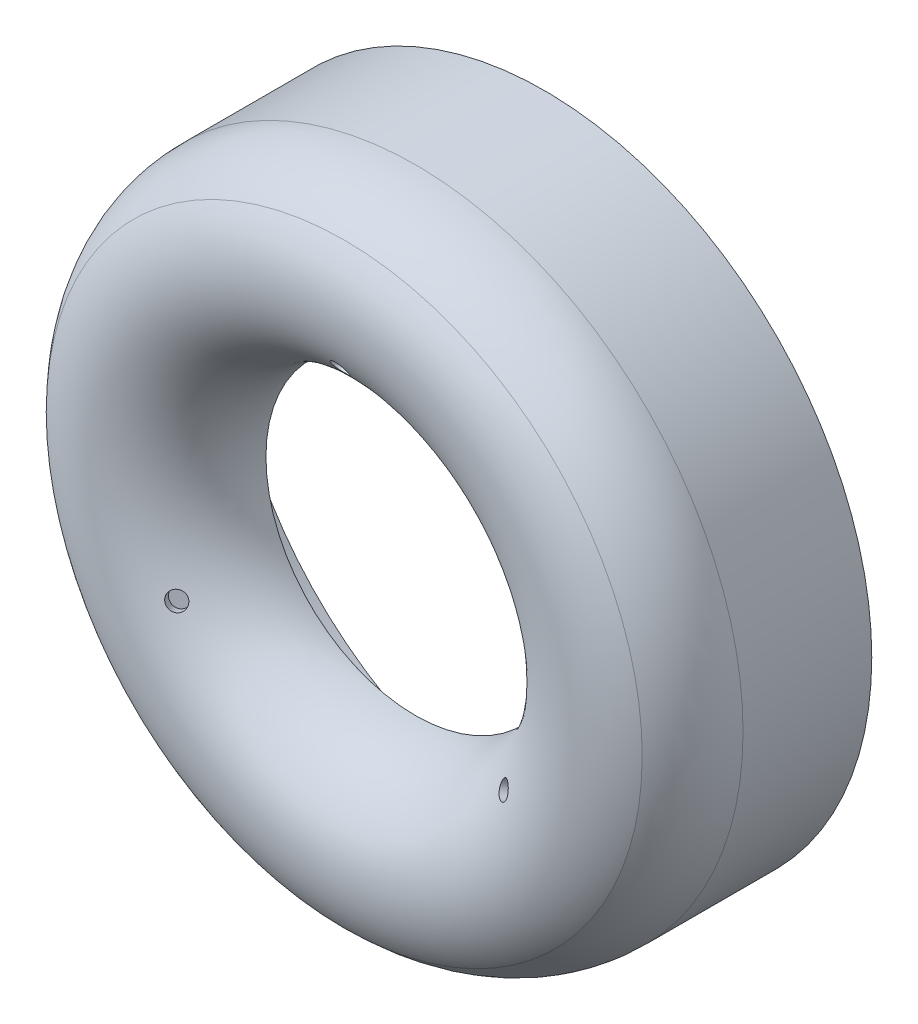
from build123d import *

# Parameters (mm, degrees)
ESQUISSE6_R                  = 1.5
ENL_V_MAT_EXTRU_5_DEPTH      = 3
R_P_TITION_CIRCULAIRE4_COUNT = 3


with BuildPart() as part:
    # Esquisse1 → Base-Révolution (revolve)
    with BuildSketch(Plane(origin=(0, 0, 0), x_dir=(0, 0, -1), z_dir=(1, 0, 0)), mode=Mode.PRIVATE) as base_r_volution_sk:
        with BuildLine():
            Line((-22.05, 25.5), (-22.05, 26.8))
            ThreePointArc((-22.05, 26.8), (-34.667475917, 34.847821439), (-32.68999151, 49.682162808))
            ThreePointArc((-32.68999151, 49.682162808), (-27.862880643, 53.19341633), (-22.05, 54.55))
            Line((-22.05, 54.55), (0, 54.55))
            Line((0, 54.55), (0, 55.85))
            Line((0, 55.85), (-21.969585692, 55.85))
            ThreePointArc((-21.969585692, 55.85), (-28.587198544, 54.596470039), (-34.190989234, 50.859938609))
            ThreePointArc((-34.190989234, 50.859938609), (-36.108183612, 34.355888829), (-22.05, 25.5))
        make_face()
    revolve(base_r_volution_sk.sketch.rotate(Axis((0, 0, 53.003727506), (0, 0, -1)), 90), axis=Axis((0, 0, 53.003727506), (0, 0, -1)))

    # Esquisse6 → Enlèv. mat.-Extru.5 (cut)
    with BuildSketch(Plane(origin=(0, -7.41473671, 12.842700706), x_dir=(-1, 0, 0), z_dir=(0, 0.49999999999999806, -0.8660254037844397))):
        with Locations(Location((0, 45.356406461, 0), (0, 0, 285.362788809))):
            Circle(ESQUISSE6_R)
    enl_v_mat_extru_5 = extrude(amount=ENL_V_MAT_EXTRU_5_DEPTH, mode=Mode.SUBTRACT)

    # Répétition circulaire4: Enlèv. mat.-Extru.5 ×3 about axis
    r_p_tition_circulaire4_axis = Axis((0, 0, 53.003727506), (0, 0, -1))
    for i in range(1, R_P_TITION_CIRCULAIRE4_COUNT):
        add(enl_v_mat_extru_5.rotate(r_p_tition_circulaire4_axis, i * 360 / R_P_TITION_CIRCULAIRE4_COUNT), mode=Mode.SUBTRACT)


solid = part.part
